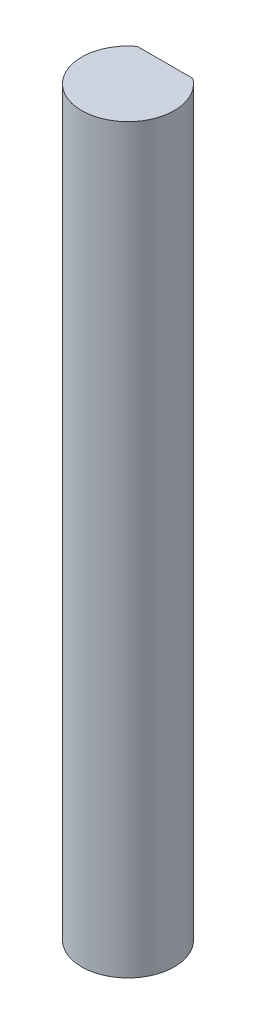
from build123d import *

# Parameters (mm, degrees)
SKETCH1_R           = 3.175
BOSS_EXTRUDE1_DEPTH = 50.8
CUT_EXTRUDE1_DEPTH  = 51.998051433


with BuildPart() as part:
    # Sketch1 → Boss-Extrude1 (new body)
    with BuildSketch(Plane(origin=(0, 0, 0), x_dir=(1, 0, 0), z_dir=(0, 1, 0))):
        with Locations(Location((0, 0, 0), (0, 0, 270))):
            Circle(SKETCH1_R)
    extrude(amount=BOSS_EXTRUDE1_DEPTH)

    # Sketch2 → Cut-Extrude1 (cut, through all)
    with BuildSketch(Plane.XZ):
        with BuildLine():
            Line((1.905, -2.54), (-1.905, -2.54))
            ThreePointArc((-1.905, -2.54), (0, -3.175), (1.905, -2.54))
        make_face()
    extrude(amount=-CUT_EXTRUDE1_DEPTH, mode=Mode.SUBTRACT)


solid = part.part
